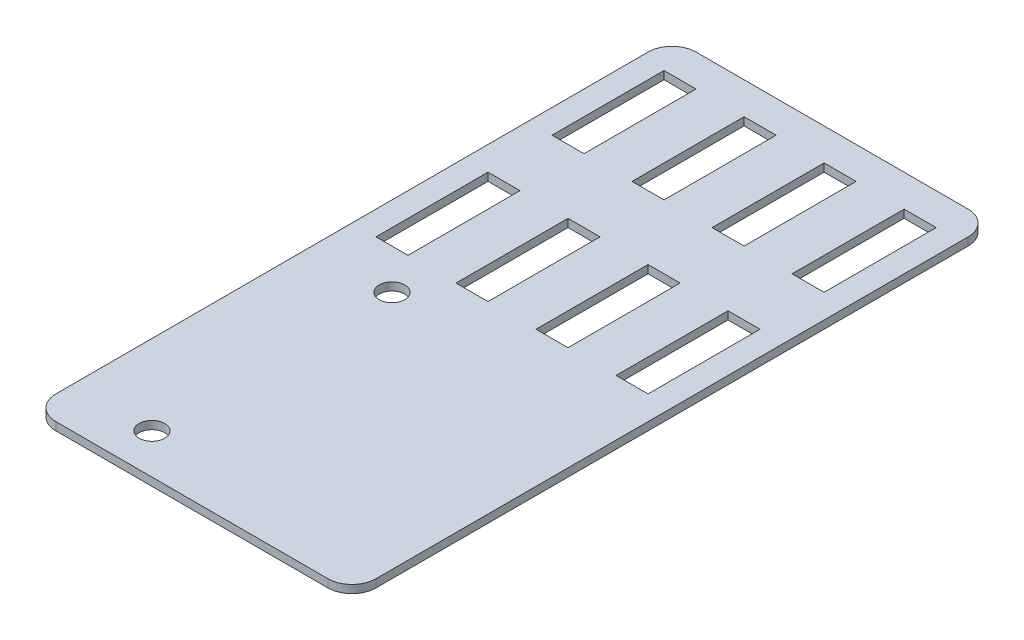
from build123d import *

# Parameters (mm, degrees)
SKETCH_1_W      = 40
SKETCH_1_H      = 80
SKETCH_1_R      = 1.6
SKETCH_1_W_2    = 4
SKETCH_1_H_2    = 14
EXTRUDE_1_DEPTH = 1
FILLET_1_R      = 3


with BuildPart() as part:
    # 草图1 → 凸台-拉伸1 (new body)
    with BuildSketch(Plane(origin=(0, 0, 0), x_dir=(1, 0, 0), z_dir=(0, 1, 0))):
        Rectangle(SKETCH_1_W, SKETCH_1_H)
        with Locations(Location((-10, -35, 0), (0, 0, 270))):
            Circle(SKETCH_1_R, mode=Mode.SUBTRACT)
        with Locations(Location((-10, -5, 0), (0, 0, 90))):
            Circle(SKETCH_1_R, mode=Mode.SUBTRACT)
        with Locations((-5, 7)):
            Rectangle(SKETCH_1_W_2, SKETCH_1_H_2, mode=Mode.SUBTRACT)
        with Locations((-15, 7)):
            Rectangle(SKETCH_1_W_2, SKETCH_1_H_2, mode=Mode.SUBTRACT)
        with Locations((5, 7)):
            Rectangle(SKETCH_1_W_2, SKETCH_1_H_2, mode=Mode.SUBTRACT)
        with Locations((15, 7)):
            Rectangle(SKETCH_1_W_2, SKETCH_1_H_2, mode=Mode.SUBTRACT)
        with Locations((-5, 29)):
            Rectangle(SKETCH_1_W_2, SKETCH_1_H_2, mode=Mode.SUBTRACT)
        with Locations((5, 29)):
            Rectangle(SKETCH_1_W_2, SKETCH_1_H_2, mode=Mode.SUBTRACT)
        with Locations((15, 29)):
            Rectangle(SKETCH_1_W_2, SKETCH_1_H_2, mode=Mode.SUBTRACT)
        with Locations((-15, 29)):
            Rectangle(SKETCH_1_W_2, SKETCH_1_H_2, mode=Mode.SUBTRACT)
    extrude(amount=EXTRUDE_1_DEPTH)

    # 圆角1
    fillet_1_edges = [part.edges().sort_by_distance(p)[0] for p in [
        (20, 0.5, 40),
        (-20, 0.5, 40),
        (-20, 0.5, -40),
        (20, 0.5, -40),
    ]]
    fillet(fillet_1_edges, radius=FILLET_1_R)


solid = part.part
